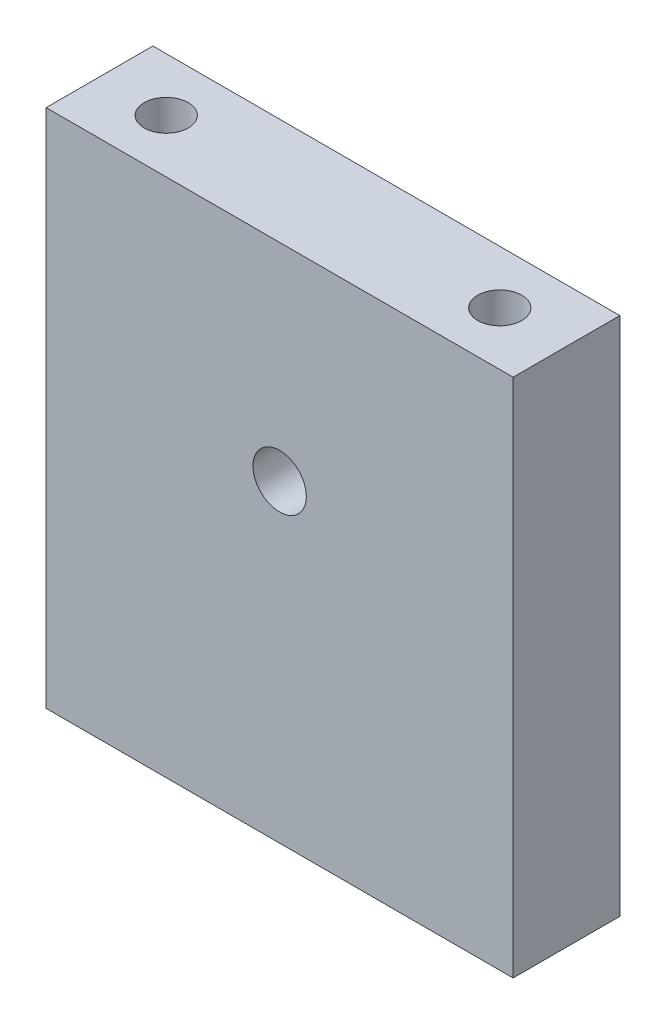
from build123d import *

# Parameters (mm, degrees)
SKETCH_1_W          = 35
SKETCH_1_H          = 39
SKETCH_1_R          = 2
EXTRUDE_1_DEPTH     = 8
SKETCH_2_R          = 1.65
CUT_EXTRUDE_1_DEPTH = 54.009433123


with BuildPart() as part:
    # 草图1 → 凸台-拉伸1 (new body)
    with BuildSketch(Plane.XY):
        with Locations((17.5, 19.5)):
            Rectangle(SKETCH_1_W, SKETCH_1_H)
        with Locations((17.5, 23.5)):
            Circle(SKETCH_1_R, mode=Mode.SUBTRACT)
    extrude(amount=EXTRUDE_1_DEPTH)

    # 草图2 → 切除-拉伸1 (cut, through all)
    with BuildSketch(Plane(origin=(0, 39, 0), x_dir=(1, 0, 0), z_dir=(0, 1, 0))):
        with Locations(Location((5, -4, 0), (0, 0, 270))):
            Circle(SKETCH_2_R)
        with Locations(Location((30, -4, 0), (0, 0, 270))):
            Circle(SKETCH_2_R)
    extrude(amount=-CUT_EXTRUDE_1_DEPTH, mode=Mode.SUBTRACT)


solid = part.part
